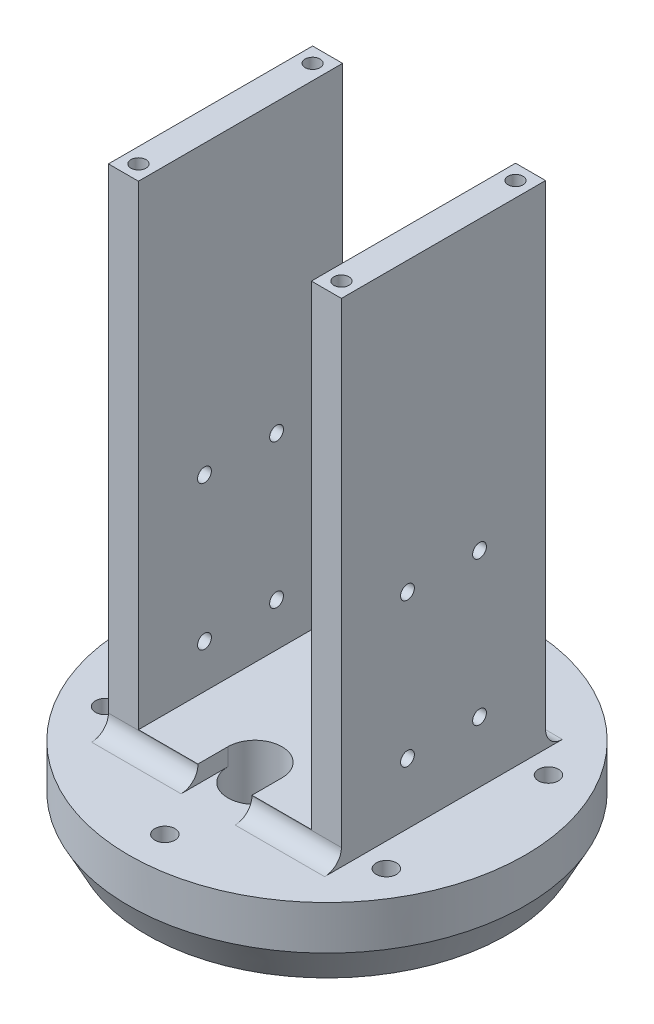
from build123d import *

# Parameters (mm, degrees)
CROQUIS2_R              = 33
SALIENTE_EXTRUIR1_DEPTH = 1
SALIENTE_EXTRUIR2_START = 6.3
CROQUIS3_R              = 33
CROQUIS3_R_2            = 27.85
SALIENTE_EXTRUIR2_DEPTH = 6.3
CROQUIS4_W              = 5
CROQUIS4_H              = 34
SALIENTE_EXTRUIR3_DEPTH = 82
CROQUIS5_W              = 28.8
CROQUIS5_H              = 34
SALIENTE_EXTRUIR4_DEPTH = 3.3
CROQUIS6_R              = 1.5
CORTAR_EXTRUIR1_DEPTH   = 5
REDONDEO2_R             = 2.8
CROQUIS7_R              = 1.25
CORTAR_EXTRUIR2_DEPTH   = 10
CROQUIS9_R              = 30
CROQUIS9_R_2            = 23.65
SALIENTE_EXTRUIR5_DEPTH = 12
CROQUIS10_R             = 23.65
SALIENTE_EXTRUIR6_DEPTH = 6.3
CROQUIS12_R             = 1.65
CORTAR_EXTRUIR4_DEPTH   = 4
CROQUIS13_R             = 1.68
CORTAR_EXTRUIR5_DEPTH   = 5
CORTAR_EXTRUIR9_REACH   = 102.76
CROQUIS14_R             = 4.5
CROQUIS16_W             = 28.8
CROQUIS16_H             = 34
CORTAR_EXTRUIR11_DEPTH  = 0.4
CORTAR_EXTRUIR12_START  = -2.9
CORTAR_EXTRUIR12_DEPTH  = 2.9
CORTAR_EXTRUIR13_REACH  = 105.556
CROQUIS18_R             = 1.15


with BuildPart() as part:
    # Croquis2 → Saliente-Extruir1 (new body)
    with BuildSketch(Plane(origin=(0, 0, 0), x_dir=(1, 0, 0), z_dir=(0, 1, 0))):
        with Locations(Location((0, 0, 0), (0, 0, 270))):
            Circle(CROQUIS2_R)
    extrude(amount=SALIENTE_EXTRUIR1_DEPTH)

    # Croquis3 → Saliente-Extruir2 (add)
    with BuildSketch(Plane.XZ.offset(SALIENTE_EXTRUIR2_START)):
        with Locations(Location((0, 0, 0), (0, 0, 270))):
            Circle(CROQUIS3_R)
        with Locations(Location((0, 0, 0), (0, 0, 270))):
            Circle(CROQUIS3_R_2, mode=Mode.SUBTRACT)
    extrude(amount=-SALIENTE_EXTRUIR2_DEPTH)

    # Croquis4 → Saliente-Extruir3 (add)
    with BuildSketch(Plane(origin=(0, 1, 0), x_dir=(1, 0, 0), z_dir=(0, 1, 0))):
        with Locations((-16.9, 0)):
            Rectangle(CROQUIS4_W, CROQUIS4_H)
        with Locations((16.9, 0)):
            Rectangle(CROQUIS4_W, CROQUIS4_H)
    extrude(amount=SALIENTE_EXTRUIR3_DEPTH)

    # Croquis5 → Saliente-Extruir4 (add)
    with BuildSketch(Plane(origin=(0, 1, 0), x_dir=(1, 0, 0), z_dir=(0, 1, 0))):
        Rectangle(CROQUIS5_W, CROQUIS5_H)
    extrude(amount=SALIENTE_EXTRUIR4_DEPTH)

    # Croquis6 → Cortar-Extruir1 (cut)
    with BuildSketch(Plane(origin=(0, 1, 0), x_dir=(1, 0, 0), z_dir=(0, 1, 0))):
        with Locations(Location((23.382685902, 13.5, 0), (0, 0, 270))):
            Circle(CROQUIS6_R)
        with Locations(Location((0, 27, 0), (0, 0, 270))):
            Circle(CROQUIS6_R)
        with Locations(Location((23.382685902, -13.5, 0), (0, 0, 270))):
            Circle(CROQUIS6_R)
        with Locations(Location((0, -27, 0), (0, 0, 270))):
            Circle(CROQUIS6_R)
        with Locations(Location((-23.382685902, -13.5, 0), (0, 0, 270))):
            Circle(CROQUIS6_R)
        with Locations(Location((-23.382685902, 13.5, 0), (0, 0, 270))):
            Circle(CROQUIS6_R)
    extrude(amount=-CORTAR_EXTRUIR1_DEPTH, mode=Mode.SUBTRACT)

    # Redondeo2
    redondeo2_edges = [part.edges().sort_by_distance(p)[0] for p in [
        (0, 1, 17),
        (0, 1, -17),
    ]]
    fillet(redondeo2_edges, radius=REDONDEO2_R)

    # Croquis7 → Cortar-Extruir2 (cut)
    with BuildSketch(Plane(origin=(0, 83, 0), x_dir=(1, 0, 0), z_dir=(0, 1, 0))):
        with Locations(Location((16.9, 14.5, 0), (0, 0, 270))):
            Circle(CROQUIS7_R)
        with Locations(Location((-16.9, 14.5, 0), (0, 0, 270))):
            Circle(CROQUIS7_R)
        with Locations(Location((-16.9, -14.5, 0), (0, 0, 270))):
            Circle(CROQUIS7_R)
        with Locations(Location((16.9, -14.5, 0), (0, 0, 270))):
            Circle(CROQUIS7_R)
    extrude(amount=-CORTAR_EXTRUIR2_DEPTH, mode=Mode.SUBTRACT)

    # Croquis9 → Saliente-Extruir5 (add)
    with BuildSketch(Plane.XZ):
        with Locations(Location((0, 0, 0), (0, 0, 270))):
            Circle(CROQUIS9_R)
        with Locations(Location((0, 0, 0), (0, 0, 270))):
            Circle(CROQUIS9_R_2, mode=Mode.SUBTRACT)
    extrude(amount=SALIENTE_EXTRUIR5_DEPTH)

    # Croquis10 → Saliente-Extruir6 (add)
    with BuildSketch(Plane.XZ):
        with Locations(Location((0, 0, 0), (0, 0, 270))):
            Circle(CROQUIS10_R)
    extrude(amount=SALIENTE_EXTRUIR6_DEPTH)

    # Croquis11 → Revolución1 (revolve)
    with BuildSketch(Plane(origin=(0, 0, 0), x_dir=(0, 0, -1), z_dir=(1, 0, 0))):
        Polygon((33, -6.3), (30, -6.3), (30, -12), align=None)
    revolve(axis=Axis((0, -12, 0), (0, 1, 0)))

    # Croquis12 → Cortar-Extruir4 (cut)
    with BuildSketch(Plane.XZ.offset(6.3)):
        with Locations(Location((-8.7777e-05, -5.499999999, 0), (0, 0, 270))):
            Circle(CROQUIS12_R)
        with Locations(Location((5.499999999, -8.7777e-05, 0), (0, 0, 270))):
            Circle(CROQUIS12_R)
        with Locations(Location((-5.499999999, 8.7777e-05, 0), (0, 0, 270))):
            Circle(CROQUIS12_R)
        with Locations(Location((8.7777e-05, 5.499999999, 0), (0, 0, 270))):
            Circle(CROQUIS12_R)
    extrude(amount=-CORTAR_EXTRUIR4_DEPTH, mode=Mode.SUBTRACT)

    # Croquis13 → Cortar-Extruir5 (cut)
    with BuildSketch(Plane(origin=(0, 1, 0), x_dir=(1, 0, 0), z_dir=(0, 1, 0))):
        with Locations(Location((-23.382685902, 13.5, 0), (0, 0, 270))):
            Circle(CROQUIS13_R)
        with Locations(Location((0, 27, 0), (0, 0, 270))):
            Circle(CROQUIS13_R)
        with Locations(Location((23.382685902, 13.5, 0), (0, 0, 270))):
            Circle(CROQUIS13_R)
        with Locations(Location((23.382685902, -13.5, 0), (0, 0, 270))):
            Circle(CROQUIS13_R)
        with Locations(Location((0, -27, 0), (0, 0, 270))):
            Circle(CROQUIS13_R)
        with Locations(Location((-23.382685902, -13.5, 0), (0, 0, 270))):
            Circle(CROQUIS13_R)
    extrude(amount=-CORTAR_EXTRUIR5_DEPTH, mode=Mode.SUBTRACT)

    # Croquis14 → Cortar-Extruir9 (cut, up to next)
    with BuildSketch(Plane.XZ.offset(6.3), mode=Mode.PRIVATE) as cortar_extruir9_sk1:
        with Locations(Location((0, 11.999999999, 0), (0, 0, 270))):
            Circle(CROQUIS14_R)
    cortar_extruir9_tool1 = extrude(cortar_extruir9_sk1.sketch, amount=-CORTAR_EXTRUIR9_REACH, mode=Mode.PRIVATE) & part.part
    add(cortar_extruir9_tool1.solids().sort_by_distance((0, -6.3, 12))[0], mode=Mode.SUBTRACT)

    # Croquis16 → Cortar-Extruir11 (cut)
    with BuildSketch(Plane(origin=(0, 4.3, 0), x_dir=(1, 0, 0), z_dir=(0, 1, 0))):
        Rectangle(CROQUIS16_W, CROQUIS16_H)
    extrude(amount=-CORTAR_EXTRUIR11_DEPTH, mode=Mode.SUBTRACT)

    # Croquis17 → Cortar-Extruir12 (cut)
    with BuildSketch(Plane(origin=(0, 3.9, 0), x_dir=(1, 0, 0), z_dir=(0, 1, 0)).offset(CORTAR_EXTRUIR12_START)):
        with BuildLine():
            Line((-4.5, -11.999999999), (-4.5, -19.8))
            Line((-4.5, -19.8), (4.5, -19.8))
            Line((4.5, -19.8), (4.5, -11.999999999))
            ThreePointArc((4.5, -11.999999999), (0, -16.499999999), (-4.5, -11.999999999))
        make_face()
    extrude(amount=CORTAR_EXTRUIR12_DEPTH, mode=Mode.SUBTRACT)

    # Cortar-Extruir13: up to this face of the body (flat: up to its plane)
    cortar_extruir13_end = Plane(part.part.faces().sort_by_distance((19.4, 41.951328943, 0))[0])
    # Croquis18 → Cortar-Extruir13 (cut, up to the picked face)
    with BuildSketch(Plane.ZY.offset(19.4), mode=Mode.PRIVATE) as cortar_extruir13_sk1:
        with Locations((6, 11.15)):
            Circle(CROQUIS18_R)
    cortar_extruir13_tool1 = split(extrude(cortar_extruir13_sk1.sketch, amount=-CORTAR_EXTRUIR13_REACH, mode=Mode.PRIVATE), bisect_by=cortar_extruir13_end, keep=Keep.BOTH, mode=Mode.PRIVATE)
    # Croquis18 → Cortar-Extruir13 (cut, up to the picked face)
    with BuildSketch(Plane.ZY.offset(19.4), mode=Mode.PRIVATE) as cortar_extruir13_sk2:
        with Locations((-6, 11.15)):
            Circle(CROQUIS18_R)
    cortar_extruir13_tool2 = split(extrude(cortar_extruir13_sk2.sketch, amount=-CORTAR_EXTRUIR13_REACH, mode=Mode.PRIVATE), bisect_by=cortar_extruir13_end, keep=Keep.BOTH, mode=Mode.PRIVATE)
    # Croquis18 → Cortar-Extruir13 (cut, up to the picked face)
    with BuildSketch(Plane.ZY.offset(19.4), mode=Mode.PRIVATE) as cortar_extruir13_sk3:
        with Locations((-6, 35.15)):
            Circle(CROQUIS18_R)
    cortar_extruir13_tool3 = split(extrude(cortar_extruir13_sk3.sketch, amount=-CORTAR_EXTRUIR13_REACH, mode=Mode.PRIVATE), bisect_by=cortar_extruir13_end, keep=Keep.BOTH, mode=Mode.PRIVATE)
    # Croquis18 → Cortar-Extruir13 (cut, up to the picked face)
    with BuildSketch(Plane.ZY.offset(19.4), mode=Mode.PRIVATE) as cortar_extruir13_sk4:
        with Locations((6, 35.15)):
            Circle(CROQUIS18_R)
    cortar_extruir13_tool4 = split(extrude(cortar_extruir13_sk4.sketch, amount=-CORTAR_EXTRUIR13_REACH, mode=Mode.PRIVATE), bisect_by=cortar_extruir13_end, keep=Keep.BOTH, mode=Mode.PRIVATE)
    add(cortar_extruir13_tool1.solids().sort_by(Axis((-19.4, 11.15, 6), (1, 0, 0)))[0], mode=Mode.SUBTRACT)
    add(cortar_extruir13_tool2.solids().sort_by(Axis((-19.4, 11.15, -6), (1, 0, 0)))[0], mode=Mode.SUBTRACT)
    add(cortar_extruir13_tool3.solids().sort_by(Axis((-19.4, 35.15, -6), (1, 0, 0)))[0], mode=Mode.SUBTRACT)
    add(cortar_extruir13_tool4.solids().sort_by(Axis((-19.4, 35.15, 6), (1, 0, 0)))[0], mode=Mode.SUBTRACT)


solid = part.part
